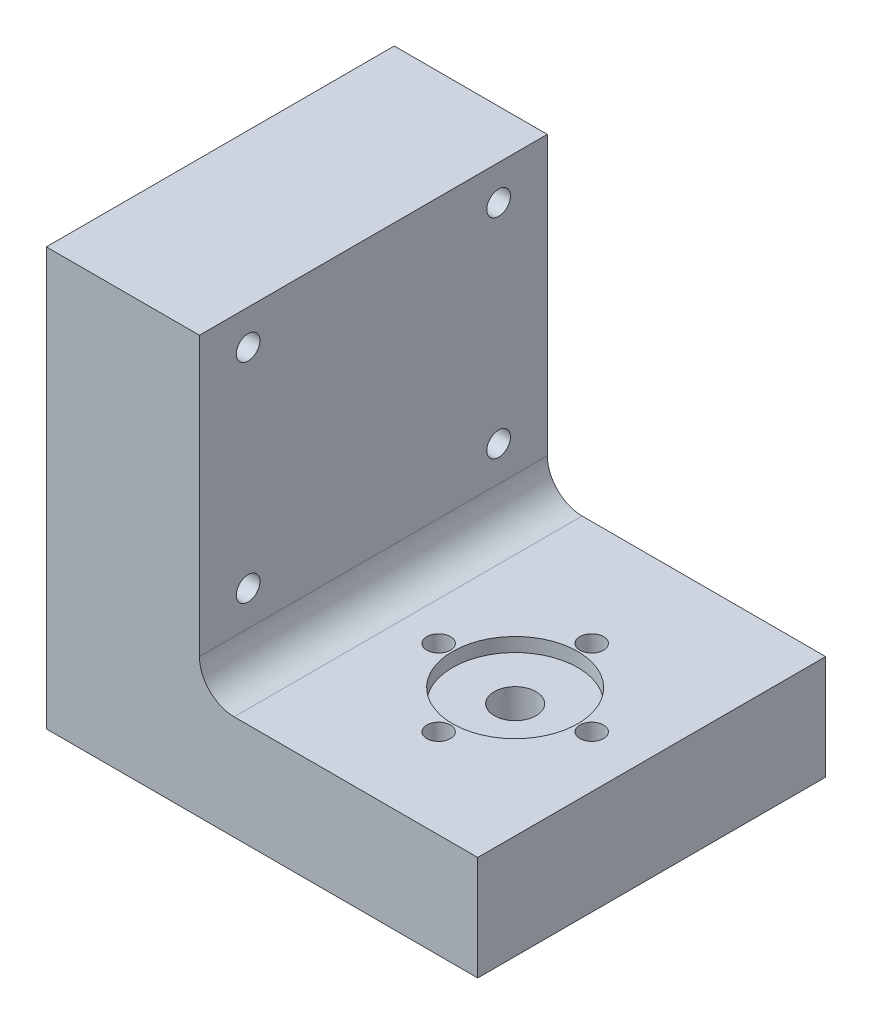
from build123d import *

# Parameters (mm, degrees)
BOSS_EXTRUDE1_DEPTH = 50
FILLET1_R           = 5
SKETCH2_R           = 1.7
CUT_EXTRUDE1_DEPTH  = 50
SKETCH3_R           = 9
CUT_EXTRUDE4_DEPTH  = 2
SKETCH4_R           = 3
CUT_EXTRUDE5_DEPTH  = 15
SKETCH5_R           = 1.7
CUT_EXTRUDE6_DEPTH  = 81.131020262


with BuildPart() as part:
    # Sketch1 → Boss-Extrude1 (new body)
    with BuildSketch(Plane.XY):
        Polygon((-43.542857143, 31.8), (-43.542857143, -28.2), (18.457142857, -28.2), (18.457142857, -13.2), (-21.542857143, -13.2), (-21.542857143, 31.8), align=None)
    extrude(amount=BOSS_EXTRUDE1_DEPTH)

    # Fillet1
    fillet1_edges = [part.edges().sort_by_distance(p)[0] for p in [
        (-21.542857143, -13.2, 25),
    ]]
    fillet(fillet1_edges, radius=FILLET1_R)

    # Sketch2 → Cut-Extrude1 (cut)
    with BuildSketch(Plane(origin=(-21.542857143, 0, 0), x_dir=(0, 0, -1), z_dir=(1, 0, 0))):
        with Locations(Location((-43, 26.8, 0), (0, 0, 90))):
            Circle(SKETCH2_R)
        with Locations(Location((-7, 26.8, 0), (0, 0, 90))):
            Circle(SKETCH2_R)
        with Locations(Location((-7, -3.2, 0), (0, 0, 90))):
            Circle(SKETCH2_R)
        with Locations(Location((-43, -3.2, 0), (0, 0, 90))):
            Circle(SKETCH2_R)
    extrude(amount=-CUT_EXTRUDE1_DEPTH, mode=Mode.SUBTRACT)

    # Sketch3 → Cut-Extrude4 (cut)
    with BuildSketch(Plane(origin=(0, -13.2, 0), x_dir=(1, 0, 0), z_dir=(0, 1, 0))):
        with Locations(Location((0, -26.167935948, 0), (0, 0, 180))):
            Circle(SKETCH3_R)
    extrude(amount=-CUT_EXTRUDE4_DEPTH, mode=Mode.SUBTRACT)

    # Sketch4 → Cut-Extrude5 (cut)
    with BuildSketch(Plane(origin=(0, -13.2, 0), x_dir=(1, 0, 0), z_dir=(0, 1, 0))):
        with Locations(Location((0, -26.167935948, 0), (0, 0, 180))):
            Circle(SKETCH4_R)
    extrude(amount=-CUT_EXTRUDE5_DEPTH, mode=Mode.SUBTRACT)

    # Sketch5 → Cut-Extrude6 (cut, through all)
    with BuildSketch(Plane(origin=(0, -13.2, 0), x_dir=(1, 0, 0), z_dir=(0, 1, 0))):
        with Locations(Location((-11, -26.167935948, 0), (0, 0, 180))):
            Circle(SKETCH5_R)
        with Locations(Location((0, -15.167935948, 0), (0, 0, 180))):
            Circle(SKETCH5_R)
        with Locations(Location((11, -26.167935948, 0), (0, 0, 180))):
            Circle(SKETCH5_R)
        with Locations(Location((0, -37.167935948, 0), (0, 0, 180))):
            Circle(SKETCH5_R)
    extrude(amount=-CUT_EXTRUDE6_DEPTH, mode=Mode.SUBTRACT)


solid = part.part
